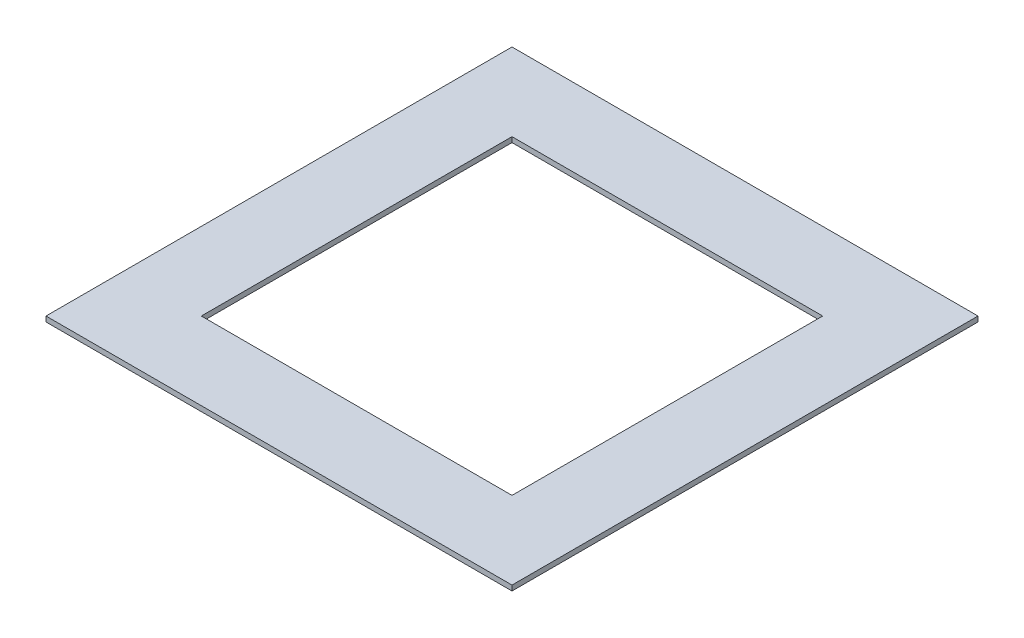
from build123d import *

# Parameters (mm, degrees)
CROQUIS1_W              = 45
CROQUIS1_H              = 45
CROQUIS1_W_2            = 30
CROQUIS1_H_2            = 30
SALIENTE_EXTRUIR1_DEPTH = 0.5


with BuildPart() as part:
    # Croquis1 → Saliente-Extruir1 (new body)
    with BuildSketch(Plane(origin=(0, 0, 0), x_dir=(1, 0, 0), z_dir=(0, 1, 0))):
        with Locations((22.5, 22.5)):
            Rectangle(CROQUIS1_W, CROQUIS1_H)
        with Locations((22.5, 22.5)):
            Rectangle(CROQUIS1_W_2, CROQUIS1_H_2, mode=Mode.SUBTRACT)
    extrude(amount=SALIENTE_EXTRUIR1_DEPTH)


solid = part.part
